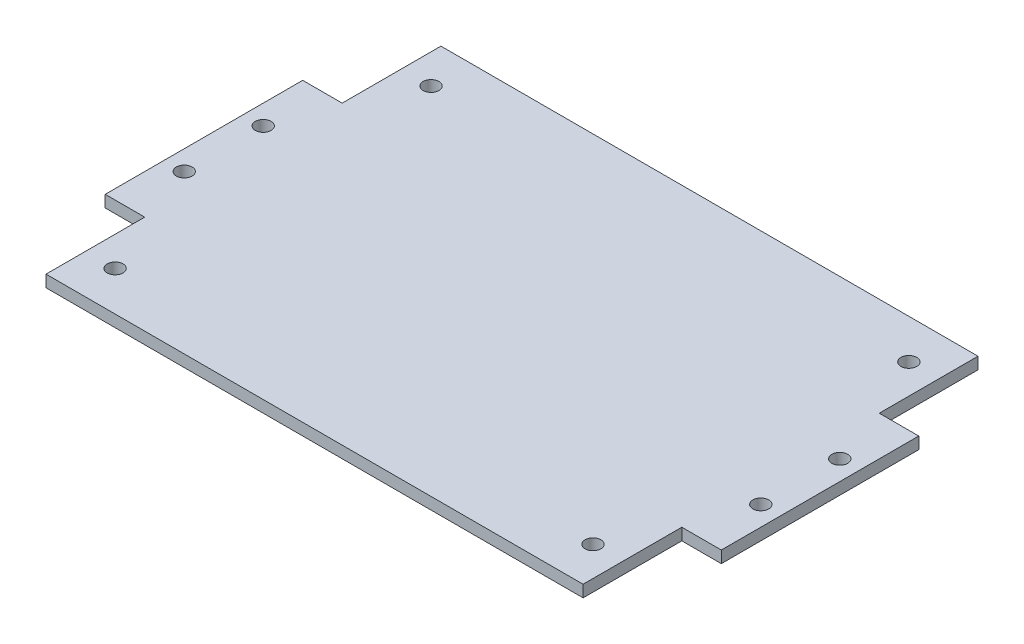
from build123d import *

# Parameters (mm, degrees)
ESBO_O2_W                = 136
ESBO_O2_H                = 100
RESSALTO_EXTRUS_O1_DEPTH = 3
ESBO_O3_R                = 2
CORTE_EXTRUS_O2_DEPTH    = 10
ESBO_O5_W                = 50
ESBO_O5_H                = 3
RESSALTO_EXTRUS_O2_DEPTH = 10
ESBO_O6_W                = 50
ESBO_O6_H                = 3
RESSALTO_EXTRUS_O3_DEPTH = 10
ESBO_O7_R                = 2
CORTE_EXTRUS_O3_DEPTH    = 10


with BuildPart() as part:
    # Esboço2 → Ressalto-extrusão1 (new body)
    with BuildSketch(Plane(origin=(0, 0, 0), x_dir=(1, 0, 0), z_dir=(0, 1, 0))):
        with Locations((-68, 50)):
            Rectangle(ESBO_O2_W, ESBO_O2_H)
    extrude(amount=RESSALTO_EXTRUS_O1_DEPTH)

    # Esboço3 → Corte-extrusão2 (cut)
    with BuildSketch(Plane(origin=(0, 3, 0), x_dir=(1, 0, 0), z_dir=(0, 1, 0))):
        with Locations(Location((-128.5, 10, 0), (0, 0, 270))):
            Circle(ESBO_O3_R)
        with Locations(Location((-7.5, 10, 0), (0, 0, 270))):
            Circle(ESBO_O3_R)
        with Locations(Location((-7.5, 90, 0), (0, 0, 270))):
            Circle(ESBO_O3_R)
        with Locations(Location((-128.5, 90, 0), (0, 0, 270))):
            Circle(ESBO_O3_R)
    extrude(amount=-CORTE_EXTRUS_O2_DEPTH, mode=Mode.SUBTRACT)

    # Esboço5 → Ressalto-extrusão2 (add)
    with BuildSketch(Plane(origin=(0, 0, 0), x_dir=(0, 0, -1), z_dir=(1, 0, 0))):
        with Locations((50, 1.5)):
            Rectangle(ESBO_O5_W, ESBO_O5_H)
    extrude(amount=RESSALTO_EXTRUS_O2_DEPTH)

    # Esboço6 → Ressalto-extrusão3 (add)
    with BuildSketch(Plane.ZY.offset(136)):
        with Locations((-50, 1.5)):
            Rectangle(ESBO_O6_W, ESBO_O6_H)
    extrude(amount=RESSALTO_EXTRUS_O3_DEPTH)

    # Esboço7 → Corte-extrusão3 (cut)
    with BuildSketch(Plane(origin=(0, 3, 0), x_dir=(1, 0, 0), z_dir=(0, 1, 0))):
        with Locations(Location((5, 40, 0), (0, 0, 270))):
            Circle(ESBO_O7_R)
        with Locations(Location((5, 60, 0), (0, 0, 270))):
            Circle(ESBO_O7_R)
        with Locations(Location((-141, 60, 0), (0, 0, 270))):
            Circle(ESBO_O7_R)
        with Locations(Location((-141, 40, 0), (0, 0, 270))):
            Circle(ESBO_O7_R)
    extrude(amount=-CORTE_EXTRUS_O3_DEPTH, mode=Mode.SUBTRACT)


solid = part.part
